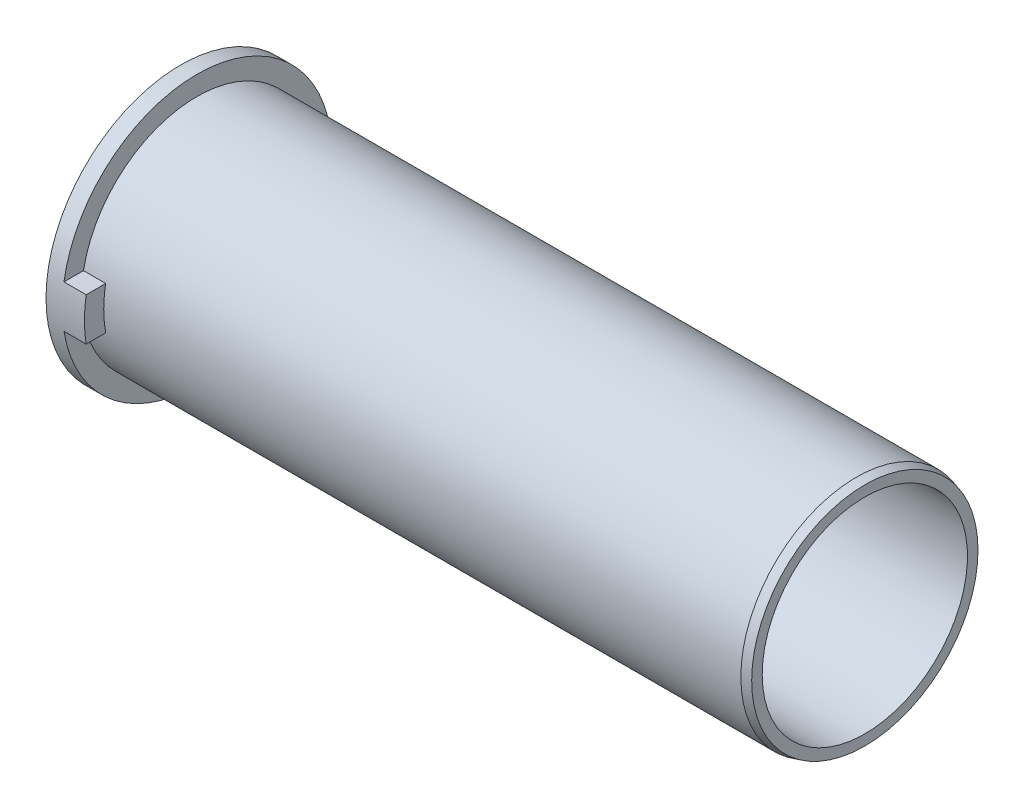
from build123d import *
from build123d.topology import SkipClean

# Parameters (mm, degrees)
RESSALTO_EXTRUS_O1_START = 0.52
RESSALTO_EXTRUS_O1_DEPTH = 0.52


with BuildPart() as part:
    # Esboço1 → Revolução1 (revolve)
    with BuildSketch(Plane.XY, mode=Mode.PRIVATE) as revolu_o1_sk:
        Polygon((0.38, 2.7), (15.8, 2.7), (16, 2.646410162), (16, 2.4), (4.100420175, 2.3), (4.100420175, 1.8), (3.67, 1.8), (3.67, 2.3), (0, 2.3), (0, 3.15), (0.38, 3.15), align=None)
    revolve(revolu_o1_sk.sketch.rotate(Axis((0, 0, 0), (1, 0, 0)), 90), axis=Axis((0, 0, 0), (1, 0, 0)))

    # Esboço3 → Ressalto-extrusão1 (add)
    with SkipClean():  # the faces are left unmerged after this step: merging them gives an invalid solid
        with BuildSketch(Plane(origin=(0.38, 0, 0), x_dir=(0, 0, -1), z_dir=(1, 0, 0)).offset(RESSALTO_EXTRUS_O1_START)):
            with BuildLine():
                Line((-3.110064308, 0.5), (-2.653299832, 0.5))
                ThreePointArc((-2.653299832, 0.5), (-2.7, 0), (-2.653299832, -0.5))
                Line((-2.653299832, -0.5), (-3.110064308, -0.5))
                ThreePointArc((-3.110064308, -0.5), (-3.15, 0), (-3.110064308, 0.5))
            make_face()
            with BuildLine():
                Line((2.653299832, -0.5), (3.110064308, -0.5))
                ThreePointArc((3.110064308, -0.5), (3.15, 0), (3.110064308, 0.5))
                Line((3.110064308, 0.5), (2.653299832, 0.5))
                ThreePointArc((2.653299832, 0.5), (2.7, 0), (2.653299832, -0.5))
            make_face()
        extrude(amount=-RESSALTO_EXTRUS_O1_DEPTH)


solid = part.part
